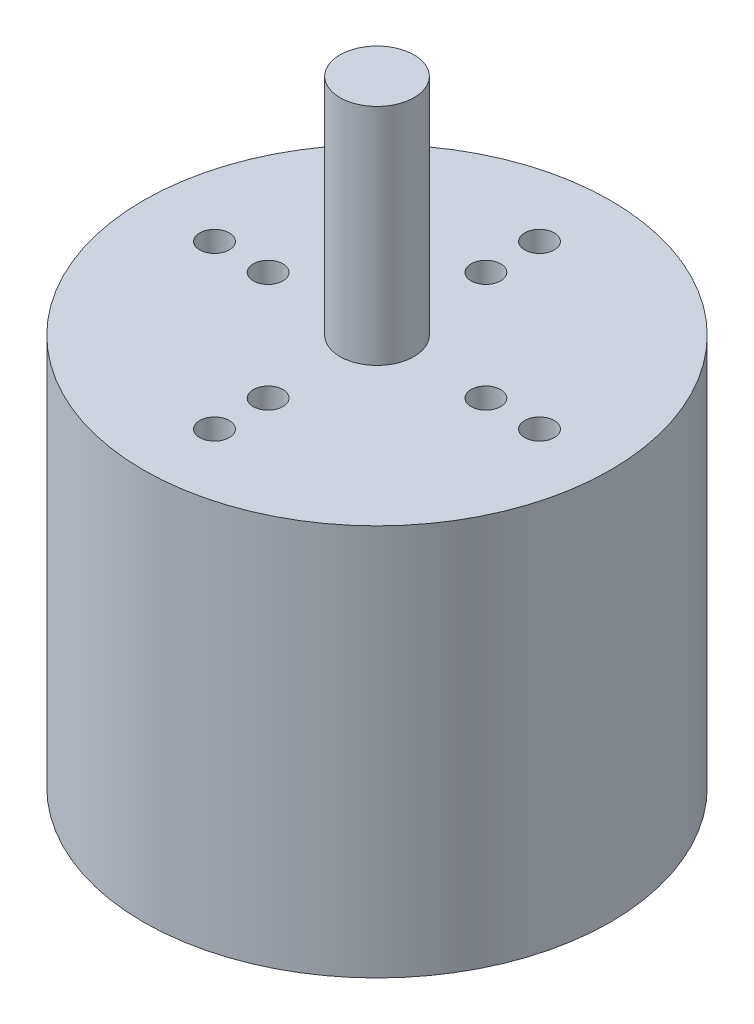
from build123d import *

# Parameters (mm, degrees)
SKETCH1_R           = 31.525
BOSS_EXTRUDE1_DEPTH = 52.86
SKETCH2_R           = 5
BOSS_EXTRUDE2_DEPTH = 30.28
SKETCH3_R           = 2
CUT_EXTRUDE1_DEPTH  = 3
CIRPATTERN11_COUNT  = 4


with BuildPart() as part:
    # Sketch1 → Boss-Extrude1 (new body)
    with BuildSketch(Plane(origin=(0, 0, 0), x_dir=(1, 0, 0), z_dir=(0, 1, 0))):
        with Locations(Location((0, 0, 0), (0, 0, 270))):
            Circle(SKETCH1_R)
    extrude(amount=BOSS_EXTRUDE1_DEPTH)

    # Sketch2 → Boss-Extrude2 (add)
    with BuildSketch(Plane(origin=(0, 52.86, 0), x_dir=(1, 0, 0), z_dir=(0, 1, 0))):
        with Locations(Location((0, 0, 0), (0, 0, 270))):
            Circle(SKETCH2_R)
    extrude(amount=BOSS_EXTRUDE2_DEPTH)

    # Sketch3 → Cut-Extrude1 (cut)
    with BuildSketch(Plane(origin=(0, 52.86, 0), x_dir=(1, 0, 0), z_dir=(0, 1, 0))):
        with Locations(Location((0, 14.7, 0), (0, 0, 270))):
            Circle(SKETCH3_R)
        with Locations(Location((0, 21.94, 0), (0, 0, 270))):
            Circle(SKETCH3_R)
    cut_extrude1 = extrude(amount=-CUT_EXTRUDE1_DEPTH, mode=Mode.SUBTRACT)

    # CirPattern11: Cut-Extrude1 ×4 about axis
    cirpattern11_axis = Axis((0, 0, 0), (0, 1, 0))
    for i in range(1, CIRPATTERN11_COUNT):
        add(cut_extrude1.rotate(cirpattern11_axis, i * 360 / CIRPATTERN11_COUNT), mode=Mode.SUBTRACT)


solid = part.part
